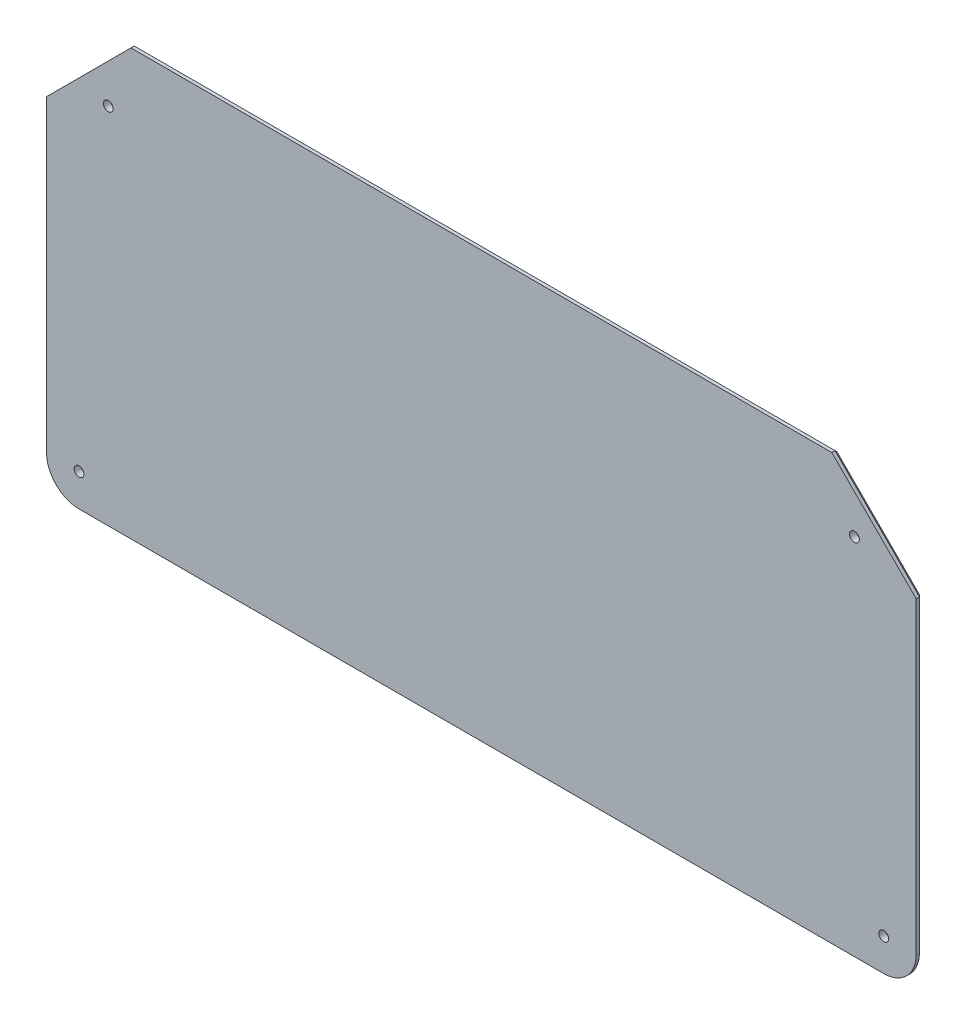
from build123d import *

# Parameters (mm, degrees)
BOSS_EXTRUDE1_DEPTH   = 2
F_3_0MM_DOWEL_HOLE1_D = 3
CHAMFER1_SIZE         = 1


with BuildPart() as part:
    # Sketch2 → Boss-Extrude1 (new body)
    with BuildSketch(Plane.XY):
        with BuildLine():
            Line((6.41186441, 110.238694526), (6.41186441, 15.286374556))
            ThreePointArc((6.41186441, 15.286374556), (9.340796598, 8.215306744), (16.41186441, 5.286374556))
            Line((16.41186441, 5.286374556), (264.168886442, 5.286374556))
            ThreePointArc((264.168886442, 5.286374556), (271.239954254, 8.215306744), (274.168886442, 15.286374556))
            Line((274.168886442, 15.286374556), (274.168886442, 110.238694526))
            Line((274.168886442, 110.238694526), (248.168886442, 136.238694526))
            Line((248.168886442, 136.238694526), (32.41186441, 136.238694526))
            Line((32.41186441, 136.238694526), (6.41186441, 110.238694526))
        make_face()
    extrude(amount=-BOSS_EXTRUDE1_DEPTH)

    # Ø3.0mm Dowel Hole1 (through all)
    with Locations(Plane.XY):
        with Locations((16.41186441, 15.286374556), (25.42227205, 117.228286886), (255.158478802, 117.228286886), (264.168886442, 15.286374556)):
            Hole(F_3_0MM_DOWEL_HOLE1_D / 2)

    # Chamfer1
    chamfer1_edges = [part.edges().sort_by_distance(p)[0] for p in [
        (6.41186441, 62.762534541, -2),
        (9.340796598, 8.215306744, -2),
        (140.290375426, 5.286374556, -2),
        (271.239954254, 8.215306744, -2),
        (19.41186441, 123.238694526, -2),
        (274.168886442, 62.762534541, -2),
        (261.168886442, 123.238694526, -2),
        (140.290375426, 136.238694526, -2),
    ]]
    chamfer(chamfer1_edges, length=CHAMFER1_SIZE)


solid = part.part
